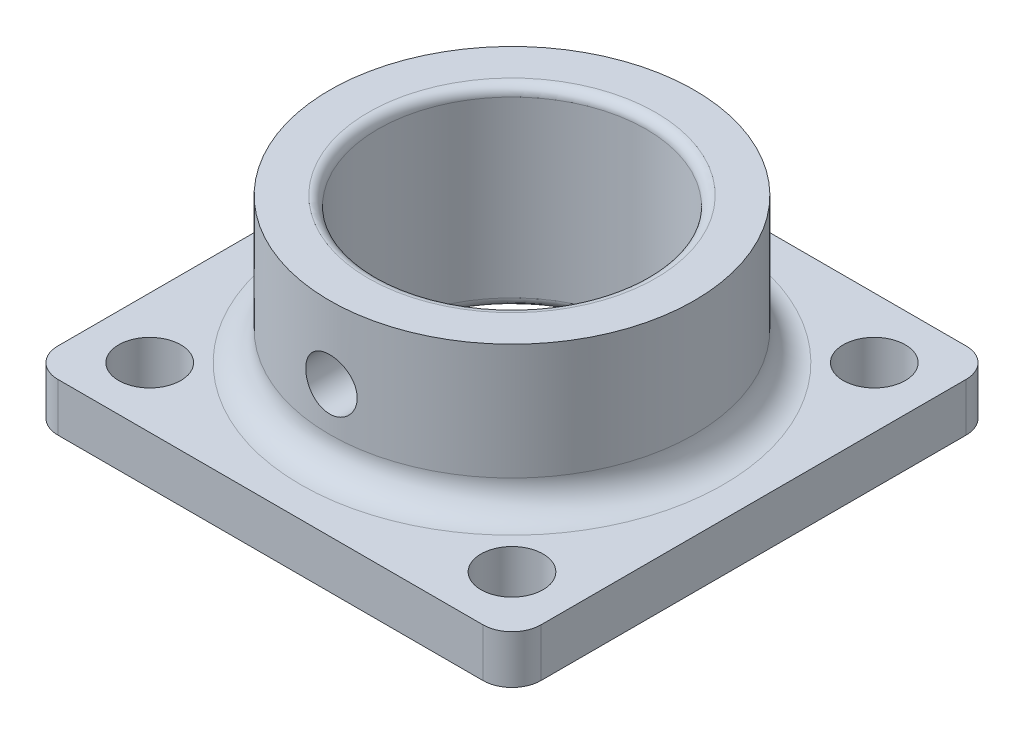
from build123d import *

# Parameters (mm, degrees)
SKETCH1_W                     = 25.4
SKETCH1_H                     = 25.4
BOSS_EXTRUDE1_DEPTH           = 2.54
SKETCH2_R                     = 9.5885
SKETCH2_R_2                   = 7.0485
EXTRUDE_THIN1_DEPTH           = 7.62
TAP_DRILL_FOR_6_32_TAP1_D     = 2.7051
TAP_DRILL_FOR_6_32_TAP1_DEPTH = 12.7
TAP_DRILL_FOR_6_32_TAP1_TIP   = 0.81269403
FILLET1_R                     = 1.524
FILLET2_R                     = 1.524
CUT_EXTRUDE1_START            = -7.62
SKETCH2_2_R                   = 7.0485
CUT_EXTRUDE1_DEPTH            = 7.62
FILLET3_R                     = 0.508
F_4_CLEARANCE_HOLE4_D         = 3.2639
F_4_CLEARANCE_HOLE4_DEPTH     = 2.54
F_4_CLEARANCE_HOLE4_TIP       = 0.980574487


with BuildPart() as part:
    # Sketch1 → Boss-Extrude1 (new body)
    with BuildSketch(Plane(origin=(0, 0, 0), x_dir=(1, 0, 0), z_dir=(0, 1, 0))):
        Rectangle(SKETCH1_W, SKETCH1_H)
    extrude(amount=BOSS_EXTRUDE1_DEPTH)

    # Sketch2 → Extrude-Thin1 (add)
    with BuildSketch(Plane(origin=(0, 2.54, 0), x_dir=(1, 0, 0), z_dir=(0, 1, 0))):
        Circle(SKETCH2_R)
        Circle(SKETCH2_R_2, mode=Mode.SUBTRACT)
    extrude(amount=EXTRUDE_THIN1_DEPTH)

    # Tap Drill for #6-32 Tap1
    with Locations(Plane.XY.offset(12.7)):
        with Locations((0, 6.35)):
            Hole(TAP_DRILL_FOR_6_32_TAP1_D / 2, depth=TAP_DRILL_FOR_6_32_TAP1_DEPTH)
            with Locations((0, 0, -(TAP_DRILL_FOR_6_32_TAP1_DEPTH + TAP_DRILL_FOR_6_32_TAP1_TIP / 2))):  # 118° drill point
                Cone(0, TAP_DRILL_FOR_6_32_TAP1_D / 2, TAP_DRILL_FOR_6_32_TAP1_TIP, mode=Mode.SUBTRACT)

    # Fillet1
    fillet1_edges = [part.edges().sort_by_distance(p)[0] for p in [
        (-9.5885, 2.54, 0),
    ]]
    fillet(fillet1_edges, radius=FILLET1_R)

    # Fillet2
    fillet2_edges = [part.edges().sort_by_distance(p)[0] for p in [
        (-12.7, 1.27, -12.7),
        (12.7, 1.27, -12.7),
        (-12.7, 1.27, 12.7),
        (12.7, 1.27, 12.7),
    ]]
    fillet(fillet2_edges, radius=FILLET2_R)

    # Sketch2<2> → Cut-Extrude1 (cut)
    with BuildSketch(Plane(origin=(0, 2.54, 0), x_dir=(1, 0, 0), z_dir=(0, 1, 0)).offset(CUT_EXTRUDE1_START)):
        Circle(SKETCH2_2_R)
    extrude(amount=CUT_EXTRUDE1_DEPTH, mode=Mode.SUBTRACT)

    # Fillet3
    fillet3_edges = [part.edges().sort_by_distance(p)[0] for p in [
        (-7.0485, 0, 0),
        (-7.0485, 10.16, 0),
    ]]
    fillet(fillet3_edges, radius=FILLET3_R)

    # #4 Clearance Hole4
    with Locations(Plane(origin=(0, 2.54, 0), x_dir=(1, 0, 0), z_dir=(0, 1, 0))):
        with Locations((9.525, 9.525), (9.525, -9.525), (-9.525, -9.525), (-9.525, 9.525)):
            Hole(F_4_CLEARANCE_HOLE4_D / 2, depth=F_4_CLEARANCE_HOLE4_DEPTH)
            with Locations((0, 0, -(F_4_CLEARANCE_HOLE4_DEPTH + F_4_CLEARANCE_HOLE4_TIP / 2))):  # 118° drill point
                Cone(0, F_4_CLEARANCE_HOLE4_D / 2, F_4_CLEARANCE_HOLE4_TIP, mode=Mode.SUBTRACT)


solid = part.part
